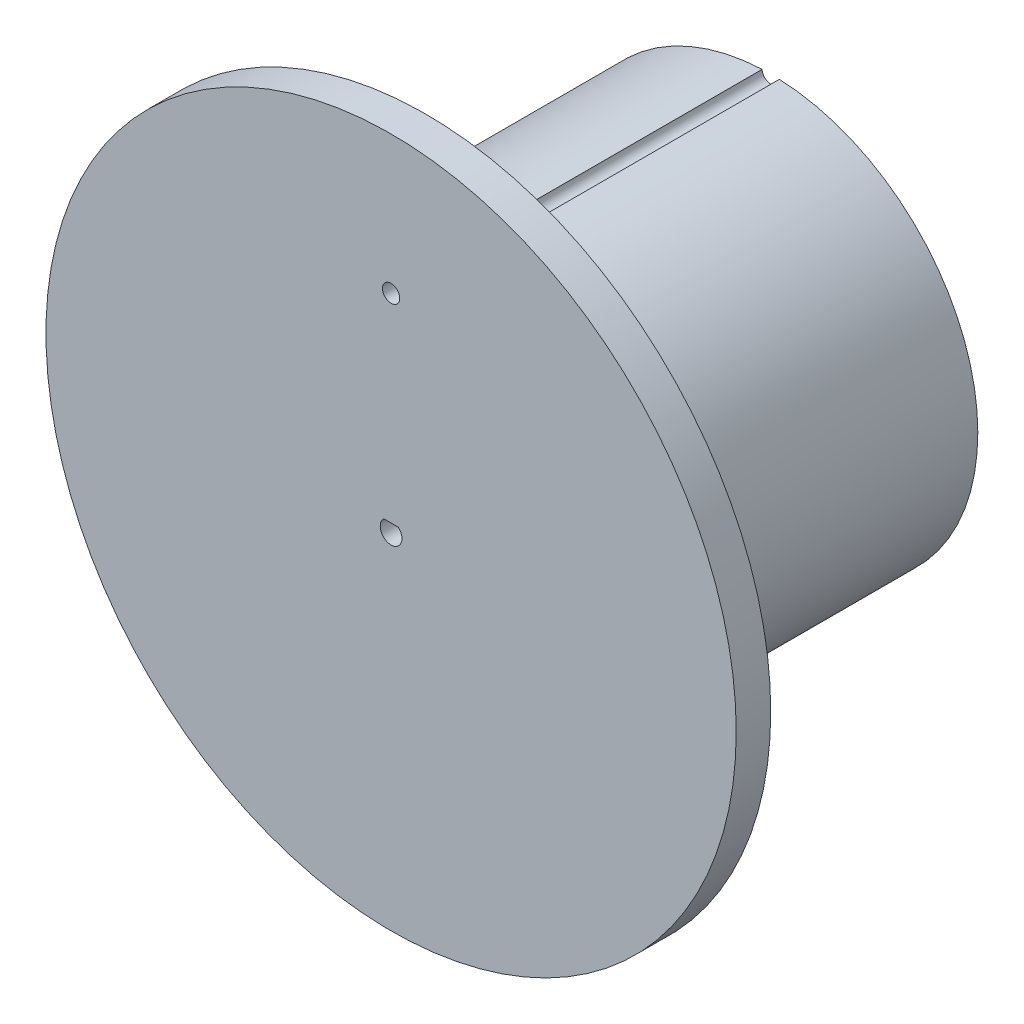
from build123d import *

# Parameters (mm, degrees)
SKETCH2_R                = 38.1
BOSS_EXTRUDE1_DEPTH      = 31.75
SKETCH5_R                = 63.5
BOSS_EXTRUDE2_DEPTH      = 6.35
CUT_EXTRUDE1_DEPTH       = 110.985226281
CUT_EXTRUDE1_DEPTH_BACK  = 110.985226281
SKETCH7_R                = 1.5875
CUT_EXTRUDE2_DEPTH       = 114.769602707
SKETCH9_R                = 4.7625
CUT_EXTRUDE3_DEPTH       = 19.05
CHAMFER1_SIZE            = 3.175
CHAMFER1_OF_MIRROR1_SIZE = 3.175


with BuildPart() as part:
    # Sketch2 → Boss-Extrude1 (new, symmetric)
    with BuildSketch(Plane.XY):
        Circle(SKETCH2_R)
    extrude(amount=BOSS_EXTRUDE1_DEPTH, both=True)

    # Sketch5 → Boss-Extrude2 (add)
    with BuildSketch(Plane.XY.offset(31.75)):
        Circle(SKETCH5_R)
    extrude(amount=BOSS_EXTRUDE2_DEPTH)

    # Sketch7 → Cut-Extrude1 (cut, two sides: drawn at the far end of the back side and taken through both)
    with BuildSketch(Plane(origin=(0, 0, 31.75), x_dir=(-1, 0, 0), z_dir=(0, 0, -1)).offset(-CUT_EXTRUDE1_DEPTH_BACK)):
        with Locations((0, 38.1)):
            Circle(SKETCH7_R)
    extrude(amount=CUT_EXTRUDE1_DEPTH + CUT_EXTRUDE1_DEPTH_BACK, mode=Mode.SUBTRACT)

    # Sketch8 → Cut-Extrude2 (cut, through all)
    with BuildSketch(Plane(origin=(0, 0, -31.75), x_dir=(-1, 0, 0), z_dir=(0, 0, -1))):
        with BuildLine():
            Line((-1.322875656, 1.5), (1.322875656, 1.5))
            ThreePointArc((1.322875656, 1.5), (0, -2), (-1.322875656, 1.5))
        make_face()
    extrude(amount=-CUT_EXTRUDE2_DEPTH, mode=Mode.SUBTRACT)

    # Sketch9 → Cut-Extrude3 (cut)
    with BuildSketch(Plane(origin=(0, 0, -31.75), x_dir=(-1, 0, 0), z_dir=(0, 0, -1))):
        with Locations((0, 19.05)):
            Circle(SKETCH9_R)
    cut_extrude3 = extrude(amount=-CUT_EXTRUDE3_DEPTH, mode=Mode.SUBTRACT)

    # Chamfer1
    chamfer1_edges = [part.edges().sort_by_distance(p)[0] for p in [
        (4.7625, 19.05, -31.75),
    ]]
    chamfer(chamfer1_edges, length=CHAMFER1_SIZE)

    # Mirror1: Cut-Extrude3 across plane
    add(cut_extrude3.mirror(Plane.ZX), mode=Mode.SUBTRACT)

    # Chamfer1 of Mirror1
    chamfer1_of_mirror1_edges = [part.edges().sort_by_distance(p)[0] for p in [
        (4.7625, -19.05, -31.75),
    ]]
    chamfer(chamfer1_of_mirror1_edges, length=CHAMFER1_OF_MIRROR1_SIZE)


solid = part.part
